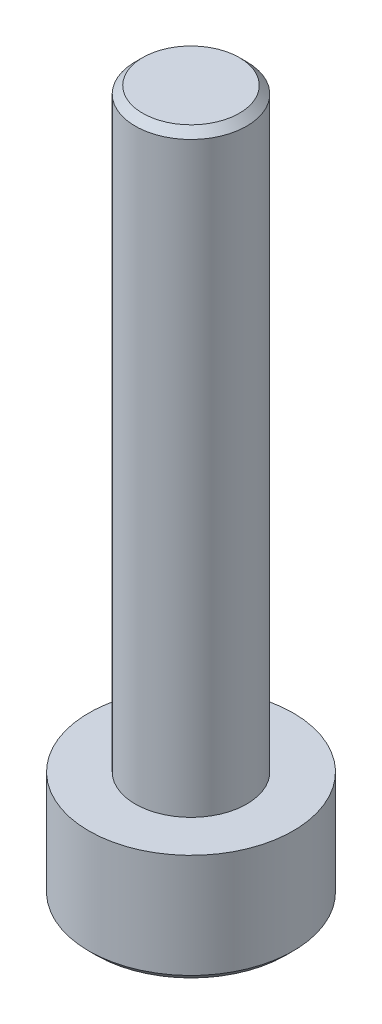
from build123d import *

# Parameters (mm, degrees)
SIMPLIFIED_START                    = -3
SIMPLIFIED_NOMINAL_HEX_SOCKET_DEPTH = 1.5


with BuildPart() as part:
    # Reconstructed nominal axial profile → Native revolved geometry (revolve)
    with BuildSketch(Plane.XY, mode=Mode.PRIVATE) as native_revolved_geometry_sk:
        Polygon((0, -3), (2.55, -3), (2.75, -2.8), (2.75, 0), (1.5, 0), (1.5, 15.8), (1.3, 16), (0, 16), align=None)
    revolve(native_revolved_geometry_sk.sketch.rotate(Axis((0, -500, 0), (0, 1, 0)), 90), axis=Axis((0, -500, 0), (0, 1, 0)))

    # Sketch2 → Simplified nominal hex socket (cut)
    with BuildSketch(Plane(origin=(0, 0, 0), x_dir=(1, 0, 0), z_dir=(0, 1, 0)).offset(SIMPLIFIED_START)):
        Polygon((1.443375673, 0), (0.721687836, -1.25), (-0.721687836, -1.25), (-1.443375673, 0), (-0.721687836, 1.25), (0.721687836, 1.25), align=None)
    extrude(amount=SIMPLIFIED_NOMINAL_HEX_SOCKET_DEPTH, mode=Mode.SUBTRACT)


solid = part.part
